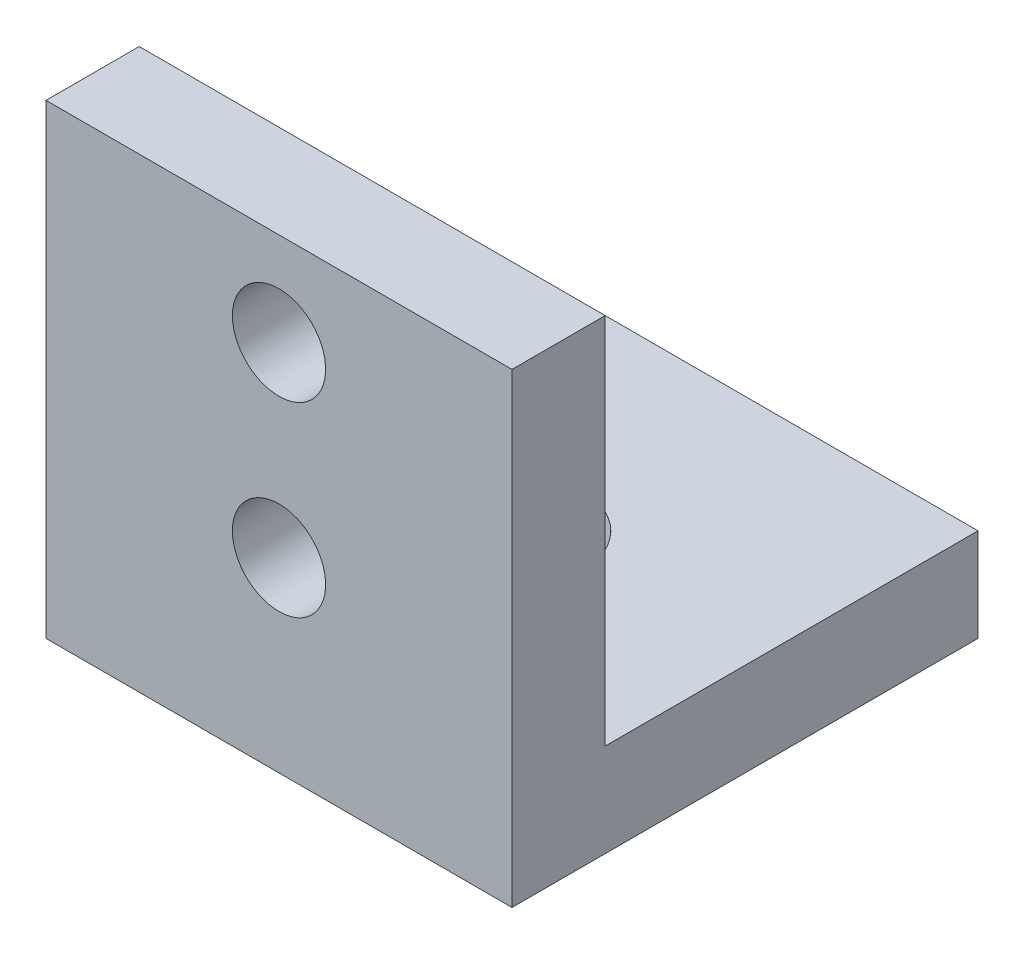
from build123d import *

# Parameters (mm, degrees)
SKETCH2_W           = 25.4
SKETCH2_H           = 25.4
SKETCH2_R           = 3.81
BOSS_EXTRUDE1_DEPTH = 5.08
SKETCH3_W           = 25.4
SKETCH3_H           = 5.08
BOSS_EXTRUDE2_DEPTH = 20.32
SKETCH4_R           = 2.54
CUT_EXTRUDE1_DEPTH  = 35.919226796


with BuildPart() as part:
    # Sketch2 → Boss-Extrude1 (new body)
    with BuildSketch(Plane(origin=(0, 0, 0), x_dir=(1, 0, 0), z_dir=(0, 1, 0))):
        Rectangle(SKETCH2_W, SKETCH2_H)
        with Locations(Location((0, 0, 0), (0, 0, 270))):
            Circle(SKETCH2_R, mode=Mode.SUBTRACT)
    extrude(amount=BOSS_EXTRUDE1_DEPTH)

    # Sketch3 → Boss-Extrude2 (add)
    with BuildSketch(Plane(origin=(0, 5.08, 0), x_dir=(1, 0, 0), z_dir=(0, 1, 0))):
        with Locations((0, -10.16)):
            Rectangle(SKETCH3_W, SKETCH3_H)
    extrude(amount=BOSS_EXTRUDE2_DEPTH)

    # Sketch4 → Cut-Extrude1 (cut, through all)
    with BuildSketch(Plane(origin=(0, 0, 7.62), x_dir=(-1, 0, 0), z_dir=(0, 0, -1))):
        with Locations((0, 20.32)):
            Circle(SKETCH4_R)
        with Locations((0, 10.16)):
            Circle(SKETCH4_R)
    extrude(amount=-CUT_EXTRUDE1_DEPTH, mode=Mode.SUBTRACT)


solid = part.part
